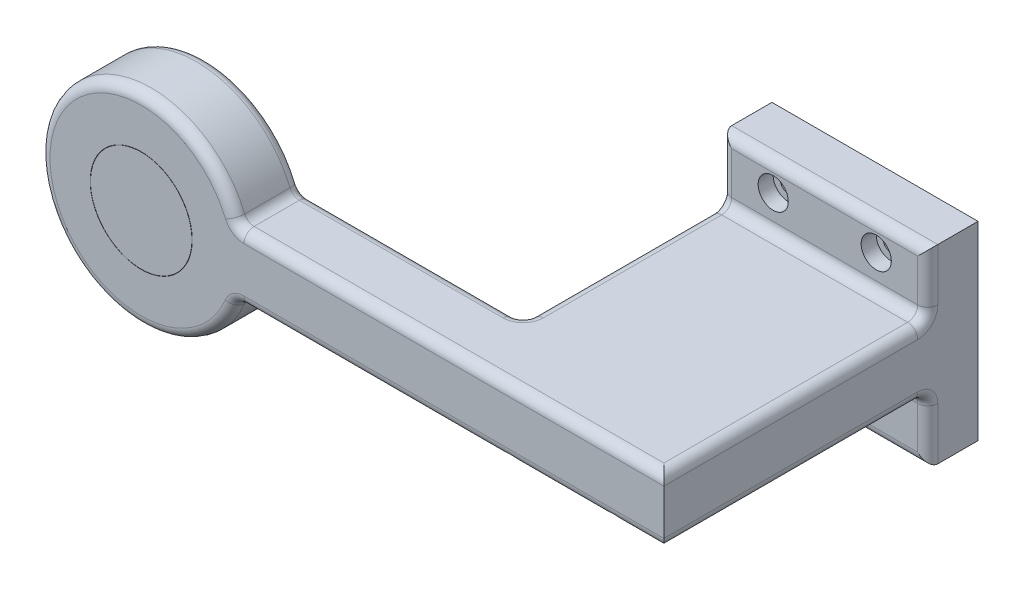
from build123d import *

# Parameters (mm, degrees)
SKETCH1_W               = 37.8
SKETCH1_H               = 41
BOSS_EXTRUDE1_DEPTH     = 10
SKETCH2_W               = 41
SKETCH2_H               = 13
BOSS_EXTRUDE2_DEPTH     = 52.5
SKETCH3_W               = 13
SKETCH3_H               = 13
BOSS_EXTRUDE3_DEPTH     = 63
SKETCH4_R               = 20.15
SKETCH4_R_2             = 10.15
EXTRUDE_THIN1_DEPTH     = 13
SKETCH5_R               = 10.15
CUT_EXTRUDE1_DEPTH      = 100
SKETCH6_R               = 10.1
BOSS_EXTRUDE4_DEPTH     = 4
FILLET2_R               = 2
SKETCH7_R               = 1.6
CUT_EXTRUDE2_DEPTH      = 123.701242963
CUT_EXTRUDE3_DEPTH      = 118.921987029
CUT_EXTRUDE3_DEPTH_BACK = 3
SKETCH8_R               = 3


with BuildPart() as part:
    # Sketch1 → Boss-Extrude1 (new body)
    with BuildSketch(Plane(origin=(0, 0, 0), x_dir=(0, 1, 0), z_dir=(0, 0, 1))):
        Rectangle(SKETCH1_W, SKETCH1_H)
    extrude(amount=BOSS_EXTRUDE1_DEPTH)

    # Sketch2 → Boss-Extrude2 (add)
    with BuildSketch(Plane.XY.offset(10)):
        Rectangle(SKETCH2_W, SKETCH2_H)
    extrude(amount=BOSS_EXTRUDE2_DEPTH)

    # Sketch3 → Boss-Extrude3 (add)
    with BuildSketch(Plane(origin=(-20.5, 0, 0), x_dir=(0, -1, 0), z_dir=(-1, 0, 0))):
        with Locations((0, 56)):
            Rectangle(SKETCH3_W, SKETCH3_H)
    extrude(amount=BOSS_EXTRUDE3_DEPTH)

    # Sketch4 → Extrude-Thin1 (add)
    with BuildSketch(Plane.XY.offset(62.5)):
        with Locations((-83.5, 0)):
            Circle(SKETCH4_R)
        with Locations((-83.5, 0)):
            Circle(SKETCH4_R_2, mode=Mode.SUBTRACT)
    extrude(amount=-EXTRUDE_THIN1_DEPTH)

    # Sketch5 → Cut-Extrude1 (cut)
    with BuildSketch(Plane.XY.offset(62.5)):
        with Locations((-83.5, 0)):
            Circle(SKETCH5_R)
    extrude(amount=-CUT_EXTRUDE1_DEPTH, mode=Mode.SUBTRACT)

    # Fillet2
    fillet2_edges = [part.edges().sort_by_distance(p)[0] for p in [
        (0, -18.9, 10),
        (-20.5, -12.7, 10),
        (20.5, 12.7, 10),
        (20.5, -12.7, 10),
        (20.5, -6.5, 36.25),
        (0, 6.5, 10),
        (20.5, 6.5, 36.25),
        (0, -6.5, 10),
        (-21.963589512, 6.5, 62.5),
        (-20.5, -6.5, 29.75),
        (-20.5, 6.5, 29.75),
        (-20.5, 0, 49.5),
        (-42.463589512, -6.5, 49.5),
        (-42.463589512, 6.5, 49.5),
        (-21.963589512, -6.5, 62.5),
        (-103.65, 0, 62.5),
        (-103.65, 0, 49.5),
        (0, 18.9, 10),
        (-64.427179024, 6.5, 56),
        (-64.427179024, -6.5, 56),
        (-20.5, 12.7, 10),
    ]]
    fillet(fillet2_edges, radius=FILLET2_R)

    # Sketch7 → Cut-Extrude2 (cut, through all)
    with BuildSketch(Plane(origin=(0, 0, 0), x_dir=(1, 0, 0), z_dir=(0, 0, -1))):
        with Locations(Location((-10.25, -13.417934674, 0), (0, 0, 180))):
            Circle(SKETCH7_R)
        with Locations(Location((-10.25, 8.602383592, 0), (0, 0, 180))):
            Circle(SKETCH7_R)
        with Locations(Location((10.25, -13.417934674, 0), (0, 0, 180))):
            Circle(SKETCH7_R)
        with Locations(Location((10.25, 8.602383592, 0), (0, 0, 180))):
            Circle(SKETCH7_R)
    extrude(amount=-CUT_EXTRUDE2_DEPTH, mode=Mode.SUBTRACT)

    # Sketch8 → Cut-Extrude3 (cut, two sides: drawn at the far end of the back side and taken through both)
    with BuildSketch(Plane.XY.offset(10).offset(-CUT_EXTRUDE3_DEPTH_BACK)):
        with Locations((10.25, 13.417934674)):
            Circle(SKETCH8_R)
        with Locations((-10.25, 13.417934674)):
            Circle(SKETCH8_R)
        with Locations(Location((-10.25, -8.602383592, 0), (0, 0, 178.04423765))):
            Circle(SKETCH8_R)
        with Locations(Location((10.25, -8.602383592, 0), (0, 0, 178.04423765))):
            Circle(SKETCH8_R)
    extrude(amount=CUT_EXTRUDE3_DEPTH + CUT_EXTRUDE3_DEPTH_BACK, mode=Mode.SUBTRACT)


with BuildPart() as body_2:
    # Sketch6 → Boss-Extrude4 (new body)
    with BuildSketch(Plane.XY.offset(62.5)):
        with Locations((-83.5, 0)):
            Circle(SKETCH6_R)
    extrude(amount=-BOSS_EXTRUDE4_DEPTH)


solid = Compound([part.part, body_2.part])
